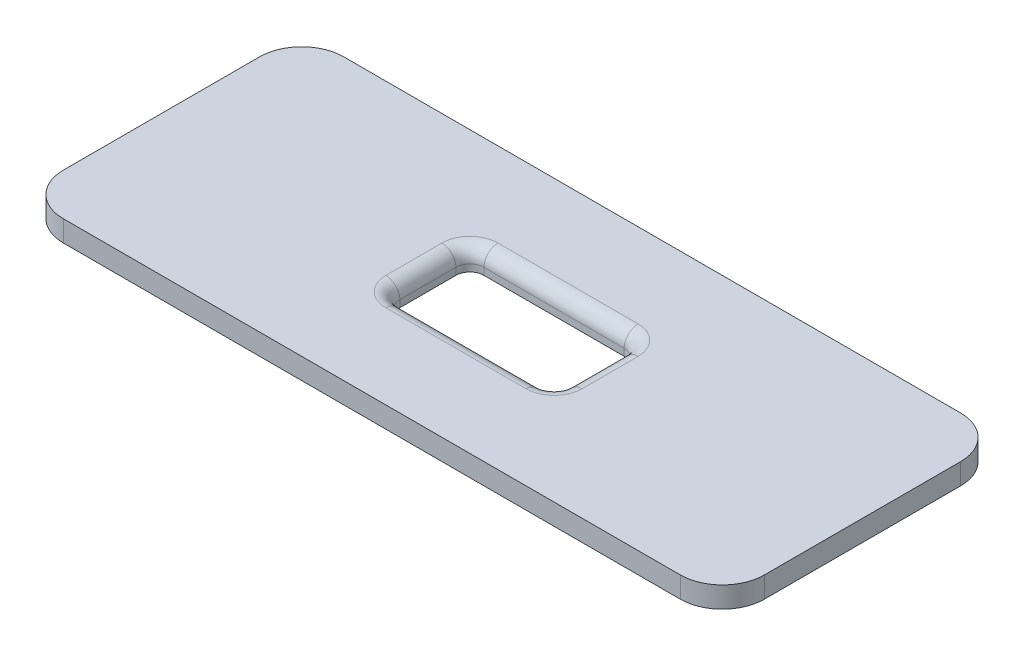
from build123d import *

# Parameters (mm, degrees)
BOSS_EXTRUDE1_DEPTH = 1.5
FILLET1_R           = 1


with BuildPart() as part:
    # Sketch1 → Boss-Extrude1 (new body)
    with BuildSketch(Plane(origin=(0, 0, 0), x_dir=(1, 0, 0), z_dir=(0, 1, 0))):
        with BuildLine():
            Line((-22, 10), (22, 10))
            ThreePointArc((22, 10), (24.121320344, 9.121320344), (25, 7))
            Line((25, 7), (25, -7))
            ThreePointArc((25, -7), (24.121320344, -9.121320344), (22, -10))
            Line((22, -10), (-22, -10))
            ThreePointArc((-22, -10), (-24.121320344, -9.121320344), (-25, -7))
            Line((-25, -7), (-25, 7))
            ThreePointArc((-25, 7), (-24.121320344, 9.121320344), (-22, 10))
        make_face()
        with BuildLine():
            Line((-5, 3), (5, 3))
            ThreePointArc((5, 3), (5.707106781, 2.707106781), (6, 2))
            Line((6, 2), (6, -2))
            ThreePointArc((6, -2), (5.707106781, -2.707106781), (5, -3))
            Line((5, -3), (-5, -3))
            ThreePointArc((-5, -3), (-5.707106781, -2.707106781), (-6, -2))
            Line((-6, -2), (-6, 2))
            ThreePointArc((-6, 2), (-5.707106781, 2.707106781), (-5, 3))
        make_face(mode=Mode.SUBTRACT)
    extrude(amount=BOSS_EXTRUDE1_DEPTH)

    # Fillet1
    fillet1_edges = [part.edges().sort_by_distance(p)[0] for p in [
        (5.707106781, 1.5, -2.707106781),
        (0, 1.5, -3),
        (-5.707106781, 1.5, -2.707106781),
        (-6, 1.5, 0),
        (-5.707106781, 1.5, 2.707106781),
        (0, 1.5, 3),
        (5.707106781, 1.5, 2.707106781),
        (6, 1.5, 0),
    ]]
    fillet(fillet1_edges, radius=FILLET1_R)


solid = part.part
